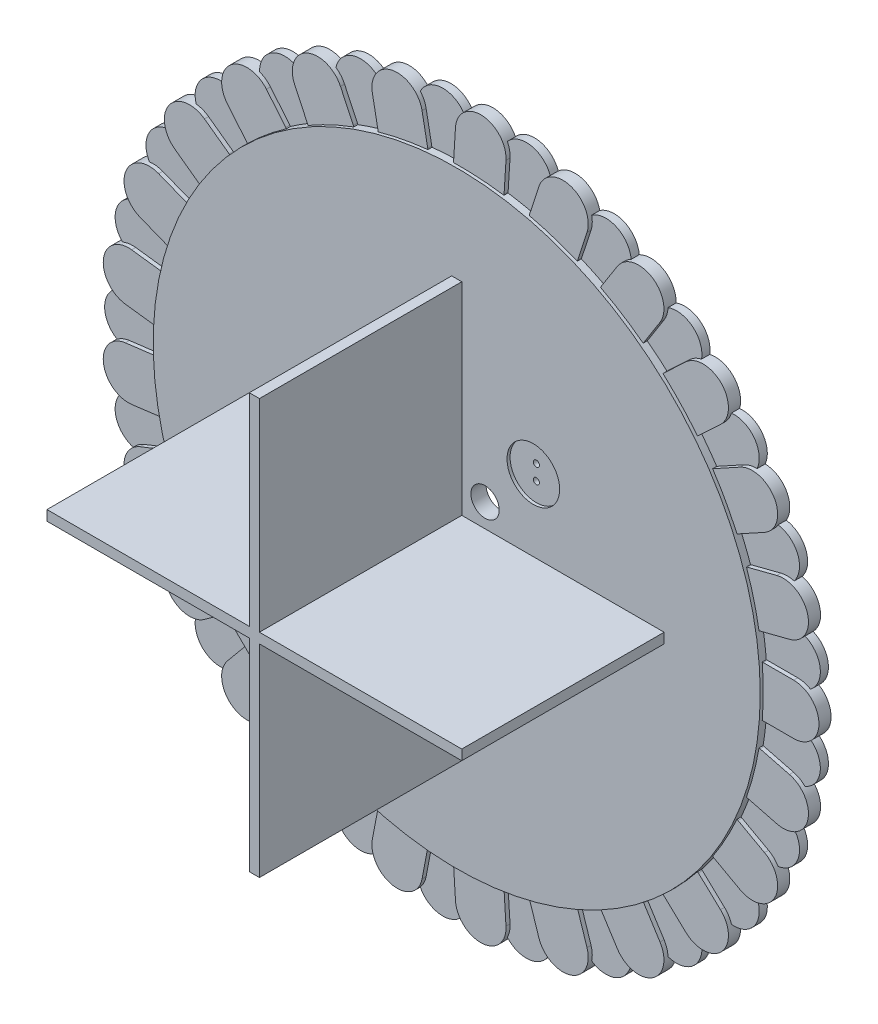
from build123d import *

# Parameters (mm, degrees)
SCHIZZO1_R                   = 30
ESTRUSIONE_ESTRUSIONE1_DEPTH = 1.5
ESTRUSIONE_ESTRUSIONE2_DEPTH = 20
SCHIZZO3_R                   = 0.3
TAGLIO_ESTRUSIONE1_DEPTH     = 47.904157598
SCHIZZO4_R                   = 2.6
TAGLIO_ESTRUSIONE2_DEPTH     = 0.3
ESTRUSIONE_ESTRUSIONE3_DEPTH = 0.8
ESTRUSIONE_ESTRUSIONE4_DEPTH = 1.2
SCHIZZO6_R                   = 1.4
TAGLIO_ESTRUSIONE3_DEPTH     = 54.998896887


with BuildPart() as part:
    # Schizzo1 → Estrusione-Estrusione1 (new body)
    with BuildSketch(Plane.XY):
        Circle(SCHIZZO1_R)
    extrude(amount=ESTRUSIONE_ESTRUSIONE1_DEPTH)

    # Schizzo2 → Estrusione-Estrusione2 (add)
    with BuildSketch(Plane.XY.offset(1.5)):
        Polygon((-0.5, 0.5), (-0.5, 20.5), (0.5, 20.5), (0.5, 0.5), (20.5, 0.5), (20.5, -0.5), (0.5, -0.5), (0.5, -20.5), (-0.5, -20.5), (-0.5, -0.5), (-20.5, -0.5), (-20.5, 0.5), align=None)
    extrude(amount=ESTRUSIONE_ESTRUSIONE2_DEPTH)

    # Schizzo3 → Taglio-Estrusione1 (cut, through all)
    with BuildSketch(Plane.XY.offset(1.5)):
        with Locations((-7.571067812, 8.321067812)):
            Circle(SCHIZZO3_R)
        with Locations((-7.571067812, 6.821067812)):
            Circle(SCHIZZO3_R)
        with Locations((-7.571067812, -8.321067812)):
            Circle(SCHIZZO3_R)
        with Locations((-7.571067812, -6.821067812)):
            Circle(SCHIZZO3_R)
        with Locations((7.571067812, -8.321067812)):
            Circle(SCHIZZO3_R)
        with Locations((7.571067812, -6.821067812)):
            Circle(SCHIZZO3_R)
        with Locations((7.571067812, 8.321067812)):
            Circle(SCHIZZO3_R)
        with Locations((7.571067812, 6.821067812)):
            Circle(SCHIZZO3_R)
    extrude(amount=-TAGLIO_ESTRUSIONE1_DEPTH, mode=Mode.SUBTRACT)

    # Schizzo4 → Taglio-Estrusione2 (cut)
    with BuildSketch(Plane.XY.offset(1.5)):
        with Locations((-7.571067812, -7.571067812)):
            Circle(SCHIZZO4_R)
        with Locations((7.571067812, -7.571067812)):
            Circle(SCHIZZO4_R)
        with Locations((7.571067812, 7.571067812)):
            Circle(SCHIZZO4_R)
        with Locations((-7.571067812, 7.571067812)):
            Circle(SCHIZZO4_R)
    extrude(amount=-TAGLIO_ESTRUSIONE2_DEPTH, mode=Mode.SUBTRACT)

    # Schizzo5 → Estrusione-Estrusione3 (add)
    with BuildSketch(Plane(origin=(0, 0, 0), x_dir=(-1, 0, 0), z_dir=(0, 0, -1))):
        with BuildLine():
            ThreePointArc((-29.895833333, -2.497828918), (-29.947905355, -2.499457171), (-30, -2.5))
            Line((-30, -2.5), (-33, -2.5))
            ThreePointArc((-33, -2.5), (-33.655910107, -2.41242242), (-34.265865799, -2.155825545))
            ThreePointArc((-34.265865799, -2.155825545), (-35.220071897, -4.449329792), (-33.725472626, -6.433477978))
            ThreePointArc((-33.725472626, -6.433477978), (-33.198492862, -6.033252754), (-32.584969035, -5.785308374))
            Line((-32.584969035, -5.785308374), (-29.679219552, -5.039238712))
            ThreePointArc((-29.679219552, -5.039238712), (-29.62862656, -5.026809076), (-29.577785546, -5.015436389))
            ThreePointArc((-29.577785546, -5.015436389), (-29.763441039, -3.759997007), (-29.895833333, -2.497828918))
        make_face()
        with BuildLine():
            ThreePointArc((-33.725472626, 6.433477978), (-35.220071897, 4.449329792), (-34.265865799, 2.155825545))
            ThreePointArc((-34.265865799, 2.155825545), (-33.655910107, 2.41242242), (-33, 2.5))
            Line((-33, 2.5), (-30, 2.5))
            ThreePointArc((-30, 2.5), (-29.947905355, 2.499457171), (-29.895833333, 2.497828918))
            ThreePointArc((-29.895833333, 2.497828918), (-29.763441039, 3.759997007), (-29.577785546, 5.015436389))
            ThreePointArc((-29.577785546, 5.015436389), (-29.62862656, 5.026809076), (-29.679219552, 5.039238712))
            Line((-29.679219552, 5.039238712), (-32.584969035, 5.785308374))
            ThreePointArc((-32.584969035, 5.785308374), (-33.198492862, 6.033252754), (-33.725472626, 6.433477978))
        make_face()
        with BuildLine():
            ThreePointArc((-31.341519599, -10.628224179), (-31.998602743, -10.70651622), (-32.653208603, -10.60967062))
            ThreePointArc((-32.653208603, -10.60967062), (-33.007065249, -13.06842162), (-31.065983974, -14.618542419))
            ThreePointArc((-31.065983974, -14.618542419), (-30.655092214, -14.099836468), (-30.122504627, -13.707104545))
            Line((-30.122504627, -13.707104545), (-27.493584587, -12.261843523))
            ThreePointArc((-27.493584587, -12.261843523), (-27.447672191, -12.237222421), (-27.401256714, -12.213563382))
            ThreePointArc((-27.401256714, -12.213563382), (-27.893294577, -11.043736581), (-28.335415963, -9.854146448))
            ThreePointArc((-28.335415963, -9.854146448), (-28.385447116, -9.868673331), (-28.435770116, -9.882154518))
            Line((-28.435770116, -9.882154518), (-31.341519599, -10.628224179))
        make_face()
        with BuildLine():
            ThreePointArc((-31.065983974, 14.618542419), (-33.007065249, 13.06842162), (-32.653208603, 10.60967062))
            ThreePointArc((-32.653208603, 10.60967062), (-31.998602743, 10.70651622), (-31.341519599, 10.628224179))
            Line((-31.341519599, 10.628224179), (-28.435770116, 9.882154518))
            ThreePointArc((-28.435770116, 9.882154518), (-28.385447116, 9.868673331), (-28.335415963, 9.854146448))
            ThreePointArc((-28.335415963, 9.854146448), (-27.893294577, 11.043736581), (-27.401256714, 12.213563382))
            ThreePointArc((-27.401256714, 12.213563382), (-27.447672191, 12.237222421), (-27.493584587, 12.261843523))
            Line((-27.493584587, 12.261843523), (-30.122504627, 13.707104545))
            ThreePointArc((-30.122504627, 13.707104545), (-30.655092214, 14.099836468), (-31.065983974, 14.618542419))
        make_face()
        with BuildLine():
            ThreePointArc((-27.713736256, -18.088637945), (-28.330705486, -18.327880231), (-28.98883022, -18.396871071))
            ThreePointArc((-28.98883022, -18.396871071), (-28.7201033, -20.866376456), (-26.454505296, -21.885070076))
            ThreePointArc((-26.454505296, -21.885070076), (-26.185519381, -21.280475601), (-25.76733247, -20.767632927))
            Line((-25.76733247, -20.767632927), (-23.580426587, -18.713991609))
            ThreePointArc((-23.580426587, -18.713991609), (-23.542079634, -18.678726077), (-23.503006148, -18.644267269))
            ThreePointArc((-23.503006148, -18.644267269), (-24.270509831, -17.633557569), (-24.994580197, -16.591291715))
            ThreePointArc((-24.994580197, -16.591291715), (-25.039426841, -16.617804452), (-25.084816216, -16.643376923))
            Line((-25.084816216, -16.643376923), (-27.713736256, -18.088637945))
        make_face()
        with BuildLine():
            ThreePointArc((-26.454505296, 21.885070076), (-28.7201033, 20.866376456), (-28.98883022, 18.396871071))
            ThreePointArc((-28.98883022, 18.396871071), (-28.330705486, 18.327880231), (-27.713736256, 18.088637945))
            Line((-27.713736256, 18.088637945), (-25.084816216, 16.643376923))
            ThreePointArc((-25.084816216, 16.643376923), (-25.039426841, 16.617804452), (-24.994580197, 16.591291715))
            ThreePointArc((-24.994580197, 16.591291715), (-24.270509831, 17.633557569), (-23.503006148, 18.644267269))
            ThreePointArc((-23.503006148, 18.644267269), (-23.542079634, 18.678726077), (-23.580426587, 18.713991609))
            Line((-23.580426587, 18.713991609), (-25.76733247, 20.767632927))
            ThreePointArc((-25.76733247, 20.767632927), (-26.185519381, 21.280475601), (-26.454505296, 21.885070076))
        make_face()
        with BuildLine():
            ThreePointArc((-22.34459694, -24.412476064), (-22.88268581, -24.797636121), (-23.502977021, -25.028128453))
            ThreePointArc((-23.502977021, -25.028128453), (-22.628551636, -27.353220119), (-20.180792758, -27.776478293))
            ThreePointArc((-20.180792758, -27.776478293), (-20.070614062, -27.123984189), (-19.793104048, -26.523254554))
            Line((-19.793104048, -26.523254554), (-18.185623663, -23.990270778))
            ThreePointArc((-18.185623663, -23.990270778), (-18.157251631, -23.946576677), (-18.127975267, -23.903483276))
            ThreePointArc((-18.127975267, -23.903483276), (-19.122719692, -23.115397283), (-20.083243033, -22.285945106))
            ThreePointArc((-20.083243033, -22.285945106), (-20.120087288, -22.322777803), (-20.157691058, -22.358834746))
            Line((-20.157691058, -22.358834746), (-22.34459694, -24.412476064))
        make_face()
        with BuildLine():
            ThreePointArc((-20.180792758, 27.776478293), (-22.628551636, 27.353220119), (-23.502977021, 25.028128453))
            ThreePointArc((-23.502977021, 25.028128453), (-22.88268581, 24.797636121), (-22.34459694, 24.412476064))
            Line((-22.34459694, 24.412476064), (-20.157691058, 22.358834746))
            ThreePointArc((-20.157691058, 22.358834746), (-20.120087288, 22.322777803), (-20.083243033, 22.285945106))
            ThreePointArc((-20.083243033, 22.285945106), (-19.122719692, 23.115397283), (-18.127975267, 23.903483276))
            ThreePointArc((-18.127975267, 23.903483276), (-18.157251631, 23.946576677), (-18.185623663, 23.990270778))
            Line((-18.185623663, 23.990270778), (-19.793104048, 26.523254554))
            ThreePointArc((-19.793104048, 26.523254554), (-20.070614062, 27.123984189), (-20.180792758, 27.776478293))
        make_face()
        with BuildLine():
            ThreePointArc((-15.571464421, -29.202388529), (-15.996862828, -29.709265335), (-16.540345338, -30.086776478))
            ThreePointArc((-16.540345338, -30.086776478), (-15.115164851, -32.121360363), (-12.639046791, -31.922588224))
            ThreePointArc((-12.639046791, -31.922588224), (-12.694598247, -31.263193094), (-12.575202105, -30.612322552))
            Line((-12.575202105, -30.612322552), (-11.648151122, -27.759153003))
            ThreePointArc((-11.648151122, -27.759153003), (-11.63153673, -27.709775795), (-11.61389703, -27.660755517))
            ThreePointArc((-11.61389703, -27.660755517), (-12.773378747, -27.144811574), (-13.910001849, -26.580290603))
            ThreePointArc((-13.910001849, -26.580290603), (-13.936528655, -26.625128927), (-13.963984036, -26.669404753))
            Line((-13.963984036, -26.669404753), (-15.571464421, -29.202388529))
        make_face()
        with BuildLine():
            ThreePointArc((-12.639046791, 31.922588224), (-15.115164851, 32.121360363), (-16.540345338, 30.086776478))
            ThreePointArc((-16.540345338, 30.086776478), (-15.996862828, 29.709265335), (-15.571464421, 29.202388529))
            Line((-15.571464421, 29.202388529), (-13.963984036, 26.669404753))
            ThreePointArc((-13.963984036, 26.669404753), (-13.936528655, 26.625128927), (-13.910001849, 26.580290603))
            ThreePointArc((-13.910001849, 26.580290603), (-12.773378747, 27.144811574), (-11.61389703, 27.660755517))
            ThreePointArc((-11.61389703, 27.660755517), (-11.63153673, 27.709775795), (-11.648151122, 27.759153003))
            Line((-11.648151122, 27.759153003), (-12.575202105, 30.612322552))
            ThreePointArc((-12.575202105, 30.612322552), (-12.694598247, 31.263193094), (-12.639046791, 31.922588224))
        make_face()
        with BuildLine():
            ThreePointArc((-7.819919524, -32.157407524), (-8.105898122, -32.754152145), (-8.538422926, -33.254961685))
            ThreePointArc((-8.538422926, -33.254961685), (-6.652036668, -34.871197401), (-4.303143031, -34.062884534))
            ThreePointArc((-4.303143031, -34.062884534), (-4.520934136, -33.4380206), (-4.567153966, -32.777905739))
            Line((-4.567153966, -32.777905739), (-4.378782407, -29.783825554))
            ThreePointArc((-4.378782407, -29.783825554), (-4.374969599, -29.731867791), (-4.37007493, -29.68000076))
            ThreePointArc((-4.37007493, -29.68000076), (-5.621439438, -29.468617522), (-6.862744092, -29.204498687))
            ThreePointArc((-6.862744092, -29.204498687), (-6.877286671, -29.25452528), (-6.892868541, -29.304237975))
            Line((-6.892868541, -29.304237975), (-7.819919524, -32.157407524))
        make_face()
        with BuildLine():
            ThreePointArc((-4.303143031, 34.062884534), (-6.652036668, 34.871197401), (-8.538422926, 33.254961685))
            ThreePointArc((-8.538422926, 33.254961685), (-8.105898122, 32.754152145), (-7.819919524, 32.157407524))
            Line((-7.819919524, 32.157407524), (-6.892868541, 29.304237975))
            ThreePointArc((-6.892868541, 29.304237975), (-6.877286671, 29.25452528), (-6.862744092, 29.204498687))
            ThreePointArc((-6.862744092, 29.204498687), (-5.621439438, 29.468617522), (-4.37007493, 29.68000076))
            ThreePointArc((-4.37007493, 29.68000076), (-4.374969599, 29.731867791), (-4.378782407, 29.783825554))
            Line((-4.378782407, 29.783825554), (-4.567153966, 32.777905739))
            ThreePointArc((-4.567153966, 32.777905739), (-4.520934136, 33.4380206), (-4.303143031, 34.062884534))
        make_face()
        with BuildLine():
            ThreePointArc((0.422979677, -33.091858337), (0.294389974, -33.740975114), (0, -34.333615346))
            ThreePointArc((0, -34.333615346), (2.229063443, -35.429948859), (4.303143031, -34.062884534))
            ThreePointArc((4.303143031, -34.062884534), (3.936796893, -33.511814294), (3.727865255, -32.883932561))
            Line((3.727865255, -32.883932561), (3.165721311, -29.937070808))
            ThreePointArc((3.165721311, -29.937070808), (3.156492962, -29.885797187), (3.14833505, -29.8343424))
            ThreePointArc((3.14833505, -29.8343424), (1.883715586, -29.940801853), (0.615725117, -29.993680711))
            ThreePointArc((0.615725117, -29.993680711), (0.614080527, -30.045752219), (0.611351235, -30.097778152))
            Line((0.611351235, -30.097778152), (0.422979677, -33.091858337))
        make_face()
        with BuildLine():
            ThreePointArc((4.303143031, 34.062884534), (2.229063443, 35.429948859), (0, 34.333615346))
            ThreePointArc((0, 34.333615346), (0.294389974, 33.740975114), (0.422979677, 33.091858337))
            Line((0.422979677, 33.091858337), (0.611351235, 30.097778152))
            ThreePointArc((0.611351235, 30.097778152), (0.614080527, 30.045752219), (0.615725117, 29.993680711))
            ThreePointArc((0.615725117, 29.993680711), (1.883715586, 29.940801853), (3.14833505, 29.8343424))
            ThreePointArc((3.14833505, 29.8343424), (3.156492962, 29.885797187), (3.165721311, 29.937070808))
            Line((3.165721311, 29.937070808), (3.727865255, 32.883932561))
            ThreePointArc((3.727865255, 32.883932561), (3.936796893, 33.511814294), (4.303143031, 34.062884534))
        make_face()
        with BuildLine():
            ThreePointArc((8.639301508, -31.947025988), (8.676180466, -32.607728526), (8.538422926, -33.254961685))
            ThreePointArc((8.538422926, -33.254961685), (10.9701033, -33.762506328), (12.639046791, -31.922588224))
            ThreePointArc((12.639046791, -31.922588224), (12.147164495, -31.479937449), (11.78864899, -30.92374096))
            Line((11.78864899, -30.92374096), (10.511311116, -28.209259803))
            ThreePointArc((10.511311116, -28.209259803), (10.489621462, -28.161892034), (10.46892356, -28.114082583))
            ThreePointArc((10.46892356, -28.114082583), (9.270509831, -28.531695489), (8.055506052, -28.898249467))
            ThreePointArc((8.055506052, -28.898249467), (8.066862787, -28.949094046), (8.077157564, -29.000164235))
            Line((8.077157564, -29.000164235), (8.639301508, -31.947025988))
        make_face()
        with BuildLine():
            ThreePointArc((12.639046791, 31.922588224), (10.9701033, 33.762506328), (8.538422926, 33.254961685))
            ThreePointArc((8.538422926, 33.254961685), (8.676180466, 32.607728526), (8.639301508, 31.947025988))
            Line((8.639301508, 31.947025988), (8.077157564, 29.000164235))
            ThreePointArc((8.077157564, 29.000164235), (8.066862787, 28.949094046), (8.055506052, 28.898249467))
            ThreePointArc((8.055506052, 28.898249467), (9.270509831, 28.531695489), (10.46892356, 28.114082583))
            ThreePointArc((10.46892356, 28.114082583), (10.489621462, 28.161892034), (10.511311116, 28.209259803))
            Line((10.511311116, 28.209259803), (11.78864899, 30.92374096))
            ThreePointArc((11.78864899, 30.92374096), (12.147164495, 31.479937449), (12.639046791, 31.922588224))
        make_face()
        with BuildLine():
            ThreePointArc((16.312784253, -28.794844502), (16.51281463, -29.425618432), (16.540345338, -30.086776478))
            ThreePointArc((16.540345338, -30.086776478), (19.021851222, -29.973641355), (20.180792758, -27.776478293))
            ThreePointArc((20.180792758, -27.776478293), (19.594281078, -27.470060359), (19.108708555, -27.020496986))
            Line((19.108708555, -27.020496986), (17.196436586, -24.708957258))
            ThreePointArc((17.196436586, -24.708957258), (17.163648466, -24.668471632), (17.1317111, -24.627311562))
            ThreePointArc((17.1317111, -24.627311562), (16.074803849, -25.329837765), (14.989129915, -25.987034929))
            ThreePointArc((14.989129915, -25.987034929), (15.012774391, -26.033457827), (15.035446378, -26.080363345))
            Line((15.035446378, -26.080363345), (16.312784253, -28.794844502))
        make_face()
        with BuildLine():
            ThreePointArc((20.180792758, 27.776478293), (19.021851222, 29.973641355), (16.540345338, 30.086776478))
            ThreePointArc((16.540345338, 30.086776478), (16.51281463, 29.425618432), (16.312784253, 28.794844502))
            Line((16.312784253, 28.794844502), (15.035446378, 26.080363345))
            ThreePointArc((15.035446378, 26.080363345), (15.012774391, 26.033457827), (14.989129915, 25.987034929))
            ThreePointArc((14.989129915, 25.987034929), (16.074803849, 25.329837765), (17.1317111, 24.627311562))
            ThreePointArc((17.1317111, 24.627311562), (17.163648466, 24.668471632), (17.196436586, 24.708957258))
            Line((17.196436586, 24.708957258), (19.108708555, 27.020496986))
            ThreePointArc((19.108708555, 27.020496986), (19.594281078, 27.470060359), (20.180792758, 27.776478293))
        make_face()
        with BuildLine():
            ThreePointArc((22.961274769, -23.833377037), (23.311887921, -24.394588512), (23.502977021, -25.028128453))
            ThreePointArc((23.502977021, -25.028128453), (25.878386273, -24.30142226), (26.454505296, -21.885070076))
            ThreePointArc((26.454505296, -21.885070076), (25.810216917, -21.734138349), (25.228097684, -21.419455812))
            Line((25.228097684, -21.419455812), (22.801046701, -19.656100055))
            ThreePointArc((22.801046701, -19.656100055), (22.759220315, -19.625040433), (22.718050227, -19.593115982))
            ThreePointArc((22.718050227, -19.593115982), (21.869058823, -20.536413178), (20.98093162, -21.442959412))
            ThreePointArc((20.98093162, -21.442959412), (21.015378166, -21.482043708), (21.049002799, -21.521837309))
            Line((21.049002799, -21.521837309), (22.961274769, -23.833377037))
        make_face()
        with BuildLine():
            ThreePointArc((26.454505296, 21.885070076), (25.878386273, 24.30142226), (23.502977021, 25.028128453))
            ThreePointArc((23.502977021, 25.028128453), (23.311887921, 24.394588512), (22.961274769, 23.833377037))
            Line((22.961274769, 23.833377037), (21.049002799, 21.521837309))
            ThreePointArc((21.049002799, 21.521837309), (21.015378166, 21.482043708), (20.98093162, 21.442959412))
            ThreePointArc((20.98093162, 21.442959412), (21.869058823, 20.536413178), (22.718050227, 19.593115982))
            ThreePointArc((22.718050227, 19.593115982), (22.759220315, 19.625040433), (22.801046701, 19.656100055))
            Line((22.801046701, 19.656100055), (25.228097684, 21.419455812))
            ThreePointArc((25.228097684, 21.419455812), (25.810216917, 21.734138349), (26.454505296, 21.885070076))
        make_face()
        with BuildLine():
            ThreePointArc((28.167023945, -17.37437084), (28.646189559, -17.830756878), (28.98883022, -18.396871071))
            ThreePointArc((28.98883022, -18.396871071), (31.108887142, -17.102255431), (31.065983974, -14.618542419))
            ThreePointArc((31.065983974, -14.618542419), (30.404401905, -14.632580493), (29.762312653, -14.472551453))
            Line((29.762312653, -14.472551453), (26.972983195, -13.368177795))
            ThreePointArc((26.972983195, -13.368177795), (26.924746648, -13.348495768), (26.876930706, -13.327812867))
            ThreePointArc((26.876930706, -13.327812867), (26.289200401, -14.452610223), (25.654424229, -15.551543894))
            ThreePointArc((25.654424229, -15.551543894), (25.697508442, -15.580833777), (25.739972962, -15.611015083))
            Line((25.739972962, -15.611015083), (28.167023945, -17.37437084))
        make_face()
        with BuildLine():
            ThreePointArc((31.065983974, 14.618542419), (31.108887142, 17.102255431), (28.98883022, 18.396871071))
            ThreePointArc((28.98883022, 18.396871071), (28.646189559, 17.830756878), (28.167023945, 17.37437084))
            Line((28.167023945, 17.37437084), (25.739972962, 15.611015083))
            ThreePointArc((25.739972962, 15.611015083), (25.697508442, 15.580833777), (25.654424229, 15.551543894))
            ThreePointArc((25.654424229, 15.551543894), (26.289200401, 14.452610223), (26.876930706, 13.327812867))
            ThreePointArc((26.876930706, 13.327812867), (26.924746648, 13.348495768), (26.972983195, 13.368177795))
            Line((26.972983195, 13.368177795), (29.762312653, 14.472551453))
            ThreePointArc((29.762312653, 14.472551453), (30.404401905, 14.632580493), (31.065983974, 14.618542419))
        make_face()
        with BuildLine():
            ThreePointArc((31.602935416, -9.823669024), (32.180545753, -10.146553214), (32.653208603, -10.60967062))
            ThreePointArc((32.653208603, -10.60967062), (34.38470222, -8.828490994), (33.725472626, -6.433477978))
            ThreePointArc((33.725472626, -6.433477978), (33.088166501, -6.611603791), (32.426452059, -6.616283461))
            Line((32.426452059, -6.616283461), (29.450107956, -6.24028376))
            ThreePointArc((29.450107956, -6.24028376), (29.398492127, -6.233216021), (29.347034783, -6.225074253))
            ThreePointArc((29.347034783, -6.225074253), (29.057494834, -7.460696615), (28.715955013, -8.682967679))
            ThreePointArc((28.715955013, -8.682967679), (28.764969754, -8.700622758), (28.813605958, -8.719295366))
            Line((28.813605958, -8.719295366), (31.602935416, -9.823669024))
        make_face()
        with BuildLine():
            ThreePointArc((33.725472626, 6.433477978), (34.38470222, 8.828490994), (32.653208603, 10.60967062))
            ThreePointArc((32.653208603, 10.60967062), (32.180545753, 10.146553214), (31.602935416, 9.823669024))
            Line((31.602935416, 9.823669024), (28.813605958, 8.719295366))
            ThreePointArc((28.813605958, 8.719295366), (28.764969754, 8.700622758), (28.715955013, 8.682967679))
            ThreePointArc((28.715955013, 8.682967679), (29.057494834, 7.460696615), (29.347034783, 6.225074253))
            ThreePointArc((29.347034783, 6.225074253), (29.398492127, 6.233216021), (29.450107956, 6.24028376))
            Line((29.450107956, 6.24028376), (32.426452059, 6.616283461))
            ThreePointArc((32.426452059, 6.616283461), (33.088166501, 6.611603791), (33.725472626, 6.433477978))
        make_face()
        with BuildLine():
            ThreePointArc((33.053118227, -1.655709954), (33.692879906, -1.824804294), (34.265865799, -2.155825545))
            ThreePointArc((34.265865799, -2.155825545), (35.5, 0), (34.265865799, 2.155825545))
            ThreePointArc((34.265865799, 2.155825545), (33.692879906, 1.824804294), (33.053118227, 1.655709954))
            Line((33.053118227, 1.655709954), (30.076774123, 1.279710254))
            ThreePointArc((30.076774123, 1.279710254), (30.025022226, 1.273719612), (29.973156733, 1.26880867))
            ThreePointArc((29.973156733, 1.26880867), (30, 0), (29.973156733, -1.26880867))
            ThreePointArc((29.973156733, -1.26880867), (30.025022226, -1.273719612), (30.076774123, -1.279710254))
            Line((30.076774123, -1.279710254), (33.053118227, -1.655709954))
        make_face()
    extrude(amount=-ESTRUSIONE_ESTRUSIONE3_DEPTH)

    # Schizzo5<3> → Estrusione-Estrusione4 (add)
    with BuildSketch(Plane(origin=(0, 0, 0), x_dir=(-1, 0, 0), z_dir=(0, 0, -1))):
        with BuildLine():
            Line((-30, -2.5), (-33, -2.5))
            ThreePointArc((-33, -2.5), (-35.5, 0), (-33, 2.5))
            Line((-33, 2.5), (-30, 2.5))
            ThreePointArc((-30, 2.5), (-27.5, 0), (-30, -2.5))
        make_face()
        with BuildLine():
            Line((-28.435770116, 9.882154518), (-31.341519599, 10.628224179))
            ThreePointArc((-31.341519599, 10.628224179), (-34.38470222, 8.828490994), (-32.584969035, 5.785308374))
            Line((-32.584969035, 5.785308374), (-29.679219552, 5.039238712))
            ThreePointArc((-29.679219552, 5.039238712), (-26.636036931, 6.838971897), (-28.435770116, 9.882154518))
        make_face()
        with BuildLine():
            Line((-25.084816216, 16.643376923), (-27.713736256, 18.088637945))
            ThreePointArc((-27.713736256, 18.088637945), (-31.108887142, 17.102255431), (-30.122504627, 13.707104545))
            Line((-30.122504627, 13.707104545), (-27.493584587, 12.261843523))
            ThreePointArc((-27.493584587, 12.261843523), (-24.098433701, 13.248226038), (-25.084816216, 16.643376923))
        make_face()
        with BuildLine():
            Line((-20.157691058, 22.358834746), (-22.34459694, 24.412476064))
            ThreePointArc((-22.34459694, 24.412476064), (-25.878386273, 24.30142226), (-25.76733247, 20.767632927))
            Line((-25.76733247, 20.767632927), (-23.580426587, 18.713991609))
            ThreePointArc((-23.580426587, 18.713991609), (-20.046637254, 18.825045413), (-20.157691058, 22.358834746))
        make_face()
        with BuildLine():
            Line((-13.963984036, 26.669404753), (-15.571464421, 29.202388529))
            ThreePointArc((-15.571464421, 29.202388529), (-19.021851222, 29.973641355), (-19.793104048, 26.523254554))
            Line((-19.793104048, 26.523254554), (-18.185623663, 23.990270778))
            ThreePointArc((-18.185623663, 23.990270778), (-14.735236862, 23.219017951), (-13.963984036, 26.669404753))
        make_face()
        with BuildLine():
            Line((-6.892868541, 29.304237975), (-7.819919524, 32.157407524))
            ThreePointArc((-7.819919524, 32.157407524), (-10.9701033, 33.762506328), (-12.575202105, 30.612322552))
            Line((-12.575202105, 30.612322552), (-11.648151122, 27.759153003))
            ThreePointArc((-11.648151122, 27.759153003), (-8.497967345, 26.154054198), (-6.892868541, 29.304237975))
        make_face()
        with BuildLine():
            Line((0.611351235, 30.097778152), (0.422979677, 33.091858337))
            ThreePointArc((0.422979677, 33.091858337), (-2.229063443, 35.429948859), (-4.567153966, 32.777905739))
            Line((-4.567153966, 32.777905739), (-4.378782407, 29.783825554))
            ThreePointArc((-4.378782407, 29.783825554), (-1.726739287, 27.445735032), (0.611351235, 30.097778152))
        make_face()
        with BuildLine():
            Line((8.077157564, 29.000164235), (8.639301508, 31.947025988))
            ThreePointArc((8.639301508, 31.947025988), (6.652036668, 34.871197401), (3.727865255, 32.883932561))
            Line((3.727865255, 32.883932561), (3.165721311, 29.937070808))
            ThreePointArc((3.165721311, 29.937070808), (5.152986151, 27.012899395), (8.077157564, 29.000164235))
        make_face()
        with BuildLine():
            Line((15.035446378, 26.080363345), (16.312784253, 28.794844502))
            ThreePointArc((16.312784253, 28.794844502), (15.115164851, 32.121360363), (11.78864899, 30.92374096))
            Line((11.78864899, 30.92374096), (10.511311116, 28.209259803))
            ThreePointArc((10.511311116, 28.209259803), (11.708930518, 24.882743943), (15.035446378, 26.080363345))
        make_face()
        with BuildLine():
            Line((21.049002799, 21.521837309), (22.961274769, 23.833377037))
            ThreePointArc((22.961274769, 23.833377037), (22.628551636, 27.353220119), (19.108708555, 27.020496986))
            Line((19.108708555, 27.020496986), (17.196436586, 24.708957258))
            ThreePointArc((17.196436586, 24.708957258), (17.529159718, 21.189114176), (21.049002799, 21.521837309))
        make_face()
        with BuildLine():
            Line((25.739972962, 15.611015083), (28.167023945, 17.37437084))
            ThreePointArc((28.167023945, 17.37437084), (28.7201033, 20.866376456), (25.228097684, 21.419455812))
            Line((25.228097684, 21.419455812), (22.801046701, 19.656100055))
            ThreePointArc((22.801046701, 19.656100055), (22.247967345, 16.164094438), (25.739972962, 15.611015083))
        make_face()
        with BuildLine():
            Line((28.813605958, 8.719295366), (31.602935416, 9.823669024))
            ThreePointArc((31.602935416, 9.823669024), (33.007065249, 13.06842162), (29.762312653, 14.472551453))
            Line((29.762312653, 14.472551453), (26.972983195, 13.368177795))
            ThreePointArc((26.972983195, 13.368177795), (25.568853362, 10.123425199), (28.813605958, 8.719295366))
        make_face()
        with BuildLine():
            Line((30.076774123, 1.279710254), (33.053118227, 1.655709954))
            ThreePointArc((33.053118227, 1.655709954), (35.220071897, 4.449329792), (32.426452059, 6.616283461))
            Line((32.426452059, 6.616283461), (29.450107956, 6.24028376))
            ThreePointArc((29.450107956, 6.24028376), (27.283154286, 3.446663923), (30.076774123, 1.279710254))
        make_face()
        with BuildLine():
            Line((29.450107956, -6.24028376), (32.426452059, -6.616283461))
            ThreePointArc((32.426452059, -6.616283461), (35.220071897, -4.449329792), (33.053118227, -1.655709954))
            Line((33.053118227, -1.655709954), (30.076774123, -1.279710254))
            ThreePointArc((30.076774123, -1.279710254), (27.283154286, -3.446663923), (29.450107956, -6.24028376))
        make_face()
        with BuildLine():
            Line((26.972983195, -13.368177795), (29.762312653, -14.472551453))
            ThreePointArc((29.762312653, -14.472551453), (33.007065249, -13.06842162), (31.602935416, -9.823669024))
            Line((31.602935416, -9.823669024), (28.813605958, -8.719295366))
            ThreePointArc((28.813605958, -8.719295366), (25.568853362, -10.123425199), (26.972983195, -13.368177795))
        make_face()
        with BuildLine():
            Line((22.801046701, -19.656100055), (25.228097684, -21.419455812))
            ThreePointArc((25.228097684, -21.419455812), (28.7201033, -20.866376456), (28.167023945, -17.37437084))
            Line((28.167023945, -17.37437084), (25.739972962, -15.611015083))
            ThreePointArc((25.739972962, -15.611015083), (22.247967345, -16.164094438), (22.801046701, -19.656100055))
        make_face()
        with BuildLine():
            Line((17.196436586, -24.708957258), (19.108708555, -27.020496986))
            ThreePointArc((19.108708555, -27.020496986), (22.628551636, -27.353220119), (22.961274769, -23.833377037))
            Line((22.961274769, -23.833377037), (21.049002799, -21.521837309))
            ThreePointArc((21.049002799, -21.521837309), (17.529159718, -21.189114176), (17.196436586, -24.708957258))
        make_face()
        with BuildLine():
            Line((10.511311116, -28.209259803), (11.78864899, -30.92374096))
            ThreePointArc((11.78864899, -30.92374096), (15.115164851, -32.121360363), (16.312784253, -28.794844502))
            Line((16.312784253, -28.794844502), (15.035446378, -26.080363345))
            ThreePointArc((15.035446378, -26.080363345), (11.708930518, -24.882743943), (10.511311116, -28.209259803))
        make_face()
        with BuildLine():
            Line((3.165721311, -29.937070808), (3.727865255, -32.883932561))
            ThreePointArc((3.727865255, -32.883932561), (6.652036668, -34.871197401), (8.639301508, -31.947025988))
            Line((8.639301508, -31.947025988), (8.077157564, -29.000164235))
            ThreePointArc((8.077157564, -29.000164235), (5.152986151, -27.012899395), (3.165721311, -29.937070808))
        make_face()
        with BuildLine():
            Line((-4.378782407, -29.783825554), (-4.567153966, -32.777905739))
            ThreePointArc((-4.567153966, -32.777905739), (-2.229063443, -35.429948859), (0.422979677, -33.091858337))
            Line((0.422979677, -33.091858337), (0.611351235, -30.097778152))
            ThreePointArc((0.611351235, -30.097778152), (-1.726739287, -27.445735032), (-4.378782407, -29.783825554))
        make_face()
        with BuildLine():
            Line((-11.648151122, -27.759153003), (-12.575202105, -30.612322552))
            ThreePointArc((-12.575202105, -30.612322552), (-10.9701033, -33.762506328), (-7.819919524, -32.157407524))
            Line((-7.819919524, -32.157407524), (-6.892868541, -29.304237975))
            ThreePointArc((-6.892868541, -29.304237975), (-8.497967345, -26.154054198), (-11.648151122, -27.759153003))
        make_face()
        with BuildLine():
            Line((-18.185623663, -23.990270778), (-19.793104048, -26.523254554))
            ThreePointArc((-19.793104048, -26.523254554), (-19.021851222, -29.973641355), (-15.571464421, -29.202388529))
            Line((-15.571464421, -29.202388529), (-13.963984036, -26.669404753))
            ThreePointArc((-13.963984036, -26.669404753), (-14.735236862, -23.219017951), (-18.185623663, -23.990270778))
        make_face()
        with BuildLine():
            Line((-23.580426587, -18.713991609), (-25.76733247, -20.767632927))
            ThreePointArc((-25.76733247, -20.767632927), (-25.878386273, -24.30142226), (-22.34459694, -24.412476064))
            Line((-22.34459694, -24.412476064), (-20.157691058, -22.358834746))
            ThreePointArc((-20.157691058, -22.358834746), (-20.046637254, -18.825045413), (-23.580426587, -18.713991609))
        make_face()
        with BuildLine():
            Line((-27.493584587, -12.261843523), (-30.122504627, -13.707104545))
            ThreePointArc((-30.122504627, -13.707104545), (-31.108887142, -17.102255431), (-27.713736256, -18.088637945))
            Line((-27.713736256, -18.088637945), (-25.084816216, -16.643376923))
            ThreePointArc((-25.084816216, -16.643376923), (-24.098433701, -13.248226038), (-27.493584587, -12.261843523))
        make_face()
        with BuildLine():
            Line((-29.679219552, -5.039238712), (-32.584969035, -5.785308374))
            ThreePointArc((-32.584969035, -5.785308374), (-34.38470222, -8.828490994), (-31.341519599, -10.628224179))
            Line((-31.341519599, -10.628224179), (-28.435770116, -9.882154518))
            ThreePointArc((-28.435770116, -9.882154518), (-26.636036931, -6.838971897), (-29.679219552, -5.039238712))
        make_face()
    extrude(amount=-ESTRUSIONE_ESTRUSIONE4_DEPTH)

    # Schizzo6 → Taglio-Estrusione3 (cut, through all)
    with BuildSketch(Plane.XY.offset(1.5)):
        with Locations((-2.8, 2.8)):
            Circle(SCHIZZO6_R)
        with Locations((-2.8, -2.8)):
            Circle(SCHIZZO6_R)
        with Locations((2.8, -2.8)):
            Circle(SCHIZZO6_R)
        with Locations((2.8, 2.8)):
            Circle(SCHIZZO6_R)
    extrude(amount=-TAGLIO_ESTRUSIONE3_DEPTH, mode=Mode.SUBTRACT)


solid = part.part
